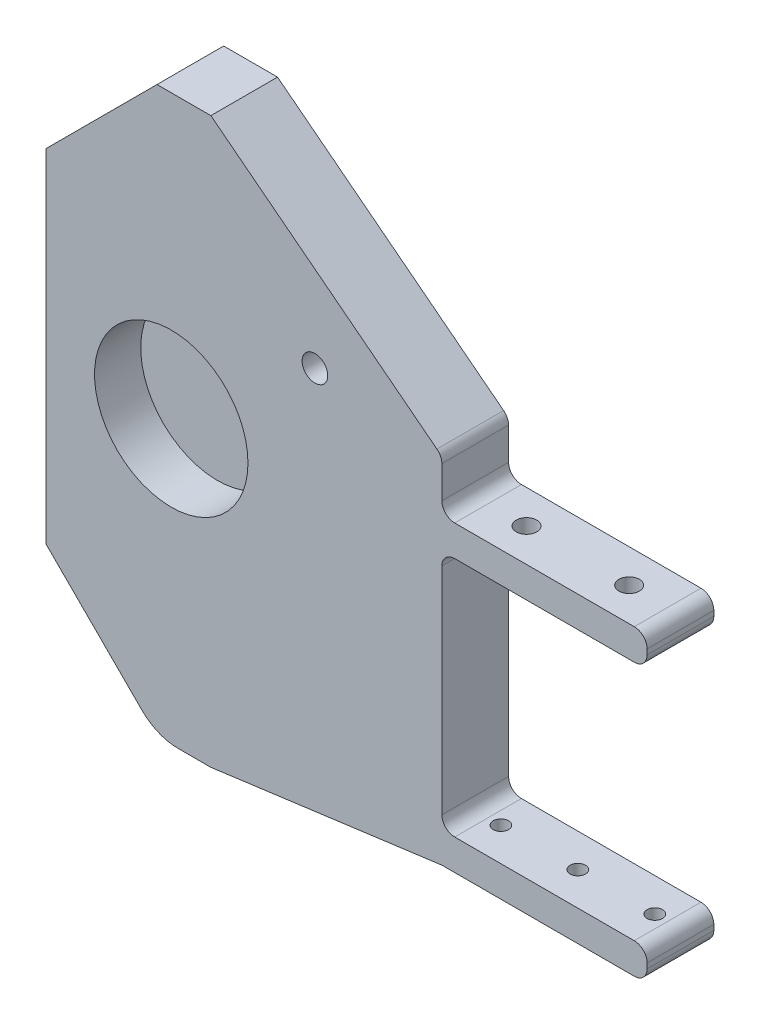
from build123d import *

# Parameters (mm, degrees)
RESSALTO_EXTRUS_O1_DEPTH = 6.5
ESBO_O2_R                = 14.95
CORTE_EXTRUS_O1_DEPTH    = 9
ESBO_O3_R                = 2.5
CORTE_EXTRUS_O2_DEPTH    = 13
FILETE1_R                = 10
ESBO_O4_R                = 2
CORTE_EXTRUS_O3_DEPTH    = 10
ESBO_O6_R                = 2
CORTE_EXTRUS_O4_DEPTH    = 10
ESBO_O7_R                = 1.5
CORTE_EXTRUS_O5_DEPTH    = 10
FILETE2_R                = 2.5


with BuildPart() as part:
    # Esboço1 → Ressalto-extrusão1 (new, symmetric)
    with BuildSketch(Plane.XY):
        Polygon((32.742040246, 55), (-22.781745931, 55), (-44.375431078, 33.406314852), (-44.375431078, -33.406314852), (-22.781745931, -55), (32.742040246, -55), (32.742040246, -49), (72.742040246, -49), (72.742040246, -43), (32.742040246, -43), (32.742040246, 4), (72.742040246, 4), (72.742040246, 10), (32.742040246, 10), align=None)
    extrude(amount=RESSALTO_EXTRUS_O1_DEPTH, both=True)

    # Esboço2 → Corte-extrusão1 (cut)
    with BuildSketch(Plane.XY.offset(6.5)):
        with Locations((-20, 0)):
            Circle(ESBO_O2_R)
    extrude(amount=-CORTE_EXTRUS_O1_DEPTH, mode=Mode.SUBTRACT)

    # Esboço3 → Corte-extrusão2 (cut)
    with BuildSketch(Plane.XY.offset(6.5)):
        with Locations((8, 22.5)):
            Circle(ESBO_O3_R)
        Polygon((-12.281745931, -55), (32.742040246, -49), (32.742040246, -55), align=None)
        Polygon((32.742040246, 55), (-12.281745931, 55), (32.742040246, 20), align=None)
    extrude(amount=-CORTE_EXTRUS_O2_DEPTH, mode=Mode.SUBTRACT)

    # Filete1
    filete1_edges = [part.edges().sort_by_distance(p)[0] for p in [
        (-22.781745931, -55, 0),
    ]]
    fillet(filete1_edges, radius=FILETE1_R)

    # Esboço4 → Corte-extrusão3 (cut)
    with BuildSketch(Plane(origin=(0, 0, -6.5), x_dir=(-1, 0, 0), z_dir=(0, 0, -1))):
        with Locations((36.375431078, 8.406314852)):
            Circle(ESBO_O4_R)
        with Locations((12.955431078, -16.593685148)):
            Circle(ESBO_O4_R)
        with Locations((22.375431078, -27.593685148)):
            Circle(ESBO_O4_R)
    extrude(amount=-CORTE_EXTRUS_O3_DEPTH, mode=Mode.SUBTRACT)

    # Esboço6 → Corte-extrusão4 (cut)
    with BuildSketch(Plane(origin=(0, 10, 0), x_dir=(1, 0, 0), z_dir=(0, 1, 0))):
        with Locations(Location((42.742040246, -0.001621735, 0), (0, 0, 270))):
            Circle(ESBO_O6_R)
        with Locations(Location((62.742040246, -0.001621735, 0), (0, 0, 270))):
            Circle(ESBO_O6_R)
    extrude(amount=-CORTE_EXTRUS_O4_DEPTH, mode=Mode.SUBTRACT)

    # Esboço7 → Corte-extrusão5 (cut)
    with BuildSketch(Plane.XZ.offset(49)):
        with Locations(Location((37.742040246, 0, 0), (0, 0, 270))):
            Circle(ESBO_O7_R)
        with Locations(Location((52.742040246, 0, 0), (0, 0, 270))):
            Circle(ESBO_O7_R)
        with Locations(Location((67.742040246, 0, 0), (0, 0, 270))):
            Circle(ESBO_O7_R)
    extrude(amount=-CORTE_EXTRUS_O5_DEPTH, mode=Mode.SUBTRACT)

    # Filete2
    filete2_edges = [part.edges().sort_by_distance(p)[0] for p in [
        (32.742040246, 10, 0),
        (72.742040246, 10, 0),
        (72.742040246, 4, 0),
        (32.742040246, 4, 0),
        (32.742040246, -43, 0),
        (72.742040246, -43, 0),
        (72.742040246, -49, 0),
        (32.742040246, 20, 0),
    ]]
    fillet(filete2_edges, radius=FILETE2_R)


solid = part.part
